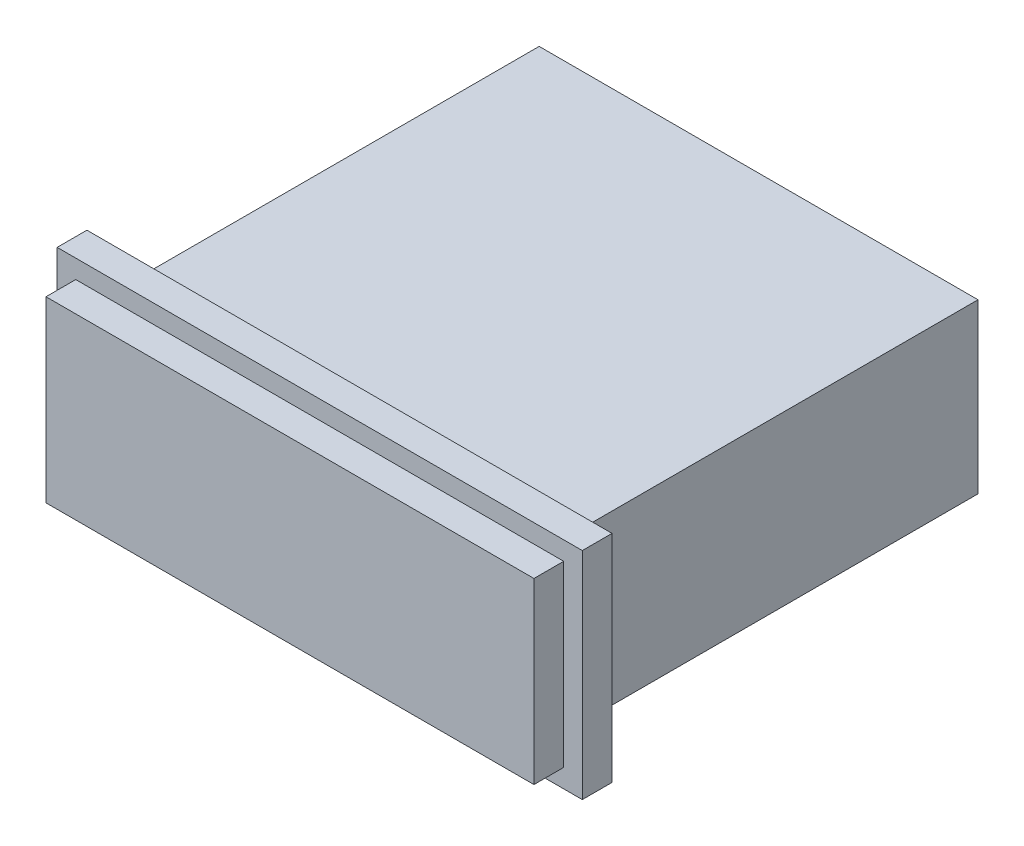
from build123d import *

# Parameters (mm, degrees)
SKETCH_1_W          = 35.3
SKETCH_1_H          = 14.5
EXTRUDE_1_DEPTH     = 4
SKETCH_2_W          = 35.3
SKETCH_2_H          = 14.5
SKETCH_2_W_2        = 32.8
SKETCH_2_H_2        = 12
CUT_EXTRUDE_1_DEPTH = 2
SKETCH_3_W          = 29.5
SKETCH_3_H          = 11.3
EXTRUDE_2_DEPTH     = 27.5


with BuildPart() as part:
    # Эскиз1 → Бобышка-Вытянуть1 (new body)
    with BuildSketch(Plane.XY):
        Rectangle(SKETCH_1_W, SKETCH_1_H)
    extrude(amount=-EXTRUDE_1_DEPTH)

    # Эскиз2 → Вырез-Вытянуть-Тонкостенный1 (cut)
    with BuildSketch(Plane.XY):
        Rectangle(SKETCH_2_W, SKETCH_2_H)
        Rectangle(SKETCH_2_W_2, SKETCH_2_H_2, mode=Mode.SUBTRACT)
    extrude(amount=-CUT_EXTRUDE_1_DEPTH, mode=Mode.SUBTRACT)

    # Эскиз3 → Бобышка-Вытянуть2 (add)
    with BuildSketch(Plane(origin=(0, 0, -4), x_dir=(-1, 0, 0), z_dir=(0, 0, -1))):
        Rectangle(SKETCH_3_W, SKETCH_3_H)
    extrude(amount=EXTRUDE_2_DEPTH)


solid = part.part
